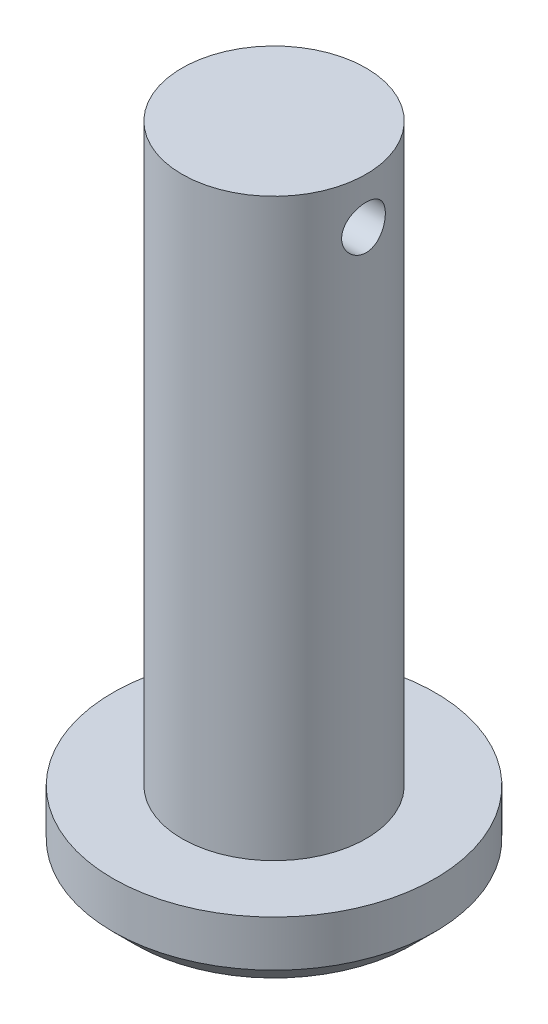
from build123d import *

# Parameters (mm, degrees)
SKETCH1_R           = 7
BOSS_EXTRUDE1_DEPTH = 3
SKETCH1_3_R         = 4
BOSS_EXTRUDE2_DEPTH = 25
SKETCH3_R           = 0.95
CUT_EXTRUDE1_DEPTH  = 29.19574436
CHAMFER1_SIZE       = 1


with BuildPart() as part:
    # Sketch1 → Boss-Extrude1 (new body)
    with BuildSketch(Plane(origin=(0, 0, 0), x_dir=(1, 0, 0), z_dir=(0, 1, 0))):
        Circle(SKETCH1_R)
    extrude(amount=-BOSS_EXTRUDE1_DEPTH)

    # Sketch1<3> → Boss-Extrude2 (add)
    with BuildSketch(Plane(origin=(0, 0, 0), x_dir=(1, 0, 0), z_dir=(0, 1, 0))):
        Circle(SKETCH1_3_R)
    extrude(amount=BOSS_EXTRUDE2_DEPTH)

    # Sketch3 → Cut-Extrude1 (cut, through all)
    with BuildSketch(Plane.ZY.offset(4)):
        with Locations((0, 23)):
            Circle(SKETCH3_R)
    extrude(amount=-CUT_EXTRUDE1_DEPTH, mode=Mode.SUBTRACT)

    # Chamfer1
    chamfer1_edges = [part.edges().sort_by_distance(p)[0] for p in [
        (-7, -3, 0),
    ]]
    chamfer(chamfer1_edges, length=CHAMFER1_SIZE)


solid = part.part
